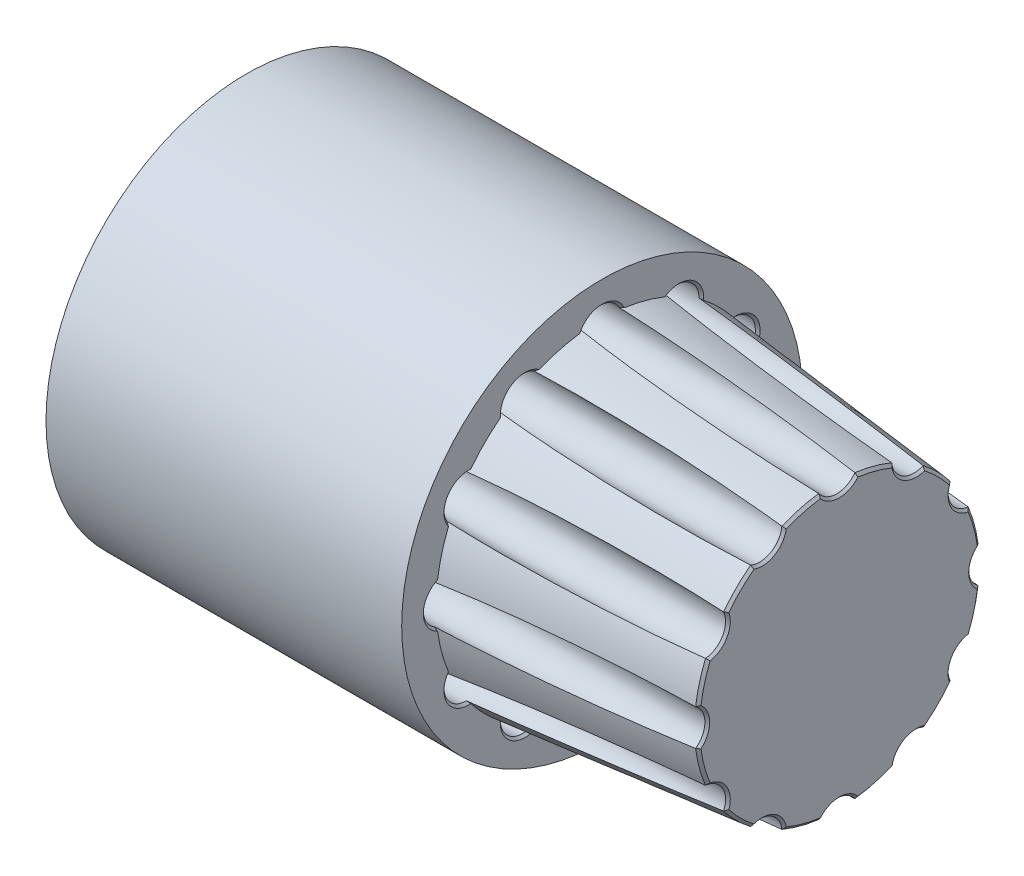
from build123d import *

# Parameters (mm, degrees)
SKETCH1_R              = 21.463
EXTRUDE1_DEPTH         = 38.1
SKETCH2_R              = 17.78
EXTRUDE2_DEPTH         = 25.4
EXTRUDE2_TAPER         = 5.75
CIRPATTERN1_COUNT      = 12
CHAMFER1_SIZE          = 0.254
CHAMFER1_SIZE2         = 0.283868516
CHAMFER1_EDGE_2_SIZE   = 0.254
CHAMFER1_EDGE_3_SIZE   = 0.254
CHAMFER1_EDGE_3_SIZE2  = 0.283868516
CHAMFER1_EDGE_4_SIZE   = 0.254
CHAMFER1_EDGE_5_SIZE   = 0.254
CHAMFER1_EDGE_5_SIZE2  = 0.283868516
CHAMFER1_EDGE_6_SIZE   = 0.254
CHAMFER1_EDGE_7_SIZE   = 0.254
CHAMFER1_EDGE_7_SIZE2  = 0.283868516
CHAMFER1_EDGE_8_SIZE   = 0.254
CHAMFER1_EDGE_9_SIZE   = 0.254
CHAMFER1_EDGE_9_SIZE2  = 0.283868516
CHAMFER1_EDGE_10_SIZE  = 0.254
CHAMFER1_EDGE_11_SIZE  = 0.254
CHAMFER1_EDGE_11_SIZE2 = 0.283868516
CHAMFER1_EDGE_12_SIZE  = 0.254
CHAMFER1_EDGE_13_SIZE  = 0.254
CHAMFER1_EDGE_13_SIZE2 = 0.283868516
CHAMFER1_EDGE_14_SIZE  = 0.254
CHAMFER1_EDGE_15_SIZE  = 0.254
CHAMFER1_EDGE_15_SIZE2 = 0.283868516
CHAMFER1_EDGE_16_SIZE  = 0.254
CHAMFER1_EDGE_17_SIZE  = 0.254
CHAMFER1_EDGE_17_SIZE2 = 0.283868516
CHAMFER1_EDGE_18_SIZE  = 0.254
CHAMFER1_EDGE_19_SIZE  = 0.254
CHAMFER1_EDGE_19_SIZE2 = 0.283868516
CHAMFER1_EDGE_20_SIZE  = 0.254
CHAMFER1_EDGE_21_SIZE  = 0.254
CHAMFER1_EDGE_21_SIZE2 = 0.283868516
CHAMFER1_EDGE_22_SIZE  = 0.254
CHAMFER1_EDGE_23_SIZE  = 0.254
CHAMFER1_EDGE_23_SIZE2 = 0.283868516
CHAMFER1_EDGE_24_SIZE  = 0.254
CHAMFER1_EDGE_25_SIZE  = 0.254
CHAMFER1_EDGE_26_SIZE  = 0.254
CHAMFER1_EDGE_27_SIZE  = 0.254
CHAMFER1_EDGE_28_SIZE  = 0.254
CHAMFER1_EDGE_29_SIZE  = 0.254
CHAMFER1_EDGE_30_SIZE  = 0.254
CHAMFER1_EDGE_31_SIZE  = 0.254
CHAMFER1_EDGE_32_SIZE  = 0.254
CHAMFER1_EDGE_33_SIZE  = 0.254
CHAMFER1_EDGE_34_SIZE  = 0.254
CHAMFER1_EDGE_35_SIZE  = 0.254
CHAMFER1_EDGE_36_SIZE  = 0.254


with BuildPart() as part:
    # Sketch1 → Extrude1 (new body)
    with BuildSketch(Plane(origin=(0, 0, 0), x_dir=(0, 0, -1), z_dir=(1, 0, 0))):
        with Locations(Location((0, 0, 0), (0, 0, 180))):
            Circle(SKETCH1_R)
    extrude(amount=EXTRUDE1_DEPTH)

    # Sketch2 → Extrude2 (add)
    with BuildSketch(Plane(origin=(38.1, 0, 0), x_dir=(0, 0, -1), z_dir=(1, 0, 0))):
        Circle(SKETCH2_R)
    extrude(amount=EXTRUDE2_DEPTH, taper=EXTRUDE2_TAPER)

    # Sketch4 → 3/16 (0.1875) Diameter Hole1 (revolve, cut)
    with BuildSketch(Plane(origin=(63.5, 0, 16.51), x_dir=(0, 0, -1), z_dir=(0, 1, 0))):
        Polygon((0, 0), (0, 33.180799349), (2.38125, 31.75), (2.38125, 0), align=None)
    f_3_16_0_1875_diameter_hole1 = revolve(axis=Axis((69.85, 0, 16.51), (-1, 0, 0)), mode=Mode.SUBTRACT)

    # CirPattern1: 3/16 (0.1875) Diameter Hole1 ×12 about axis
    cirpattern1_axis = Axis((0, 0, 0), (1, 0, 0))
    for i in range(1, CIRPATTERN1_COUNT):
        add(f_3_16_0_1875_diameter_hole1.rotate(cirpattern1_axis, i * 360 / CIRPATTERN1_COUNT), mode=Mode.SUBTRACT)

    # Chamfer1
    chamfer1_edges = [part.edges().sort_by_distance(p)[0] for p in [
        (63.5, 10.763830084, 10.763830084),
    ]]
    chamfer1_side = [part.faces().sort_by_distance(p)[0] for p in [
        (50.8, 11.668094327, 11.668094327),
    ]]
    chamfer(chamfer1_edges, length=CHAMFER1_SIZE, length2=CHAMFER1_SIZE2, reference=chamfer1_side[0])

    # Chamfer1 edge 2
    chamfer1_edge_2_edges = [part.edges().sort_by_distance(p)[0] for p in [
        (63.5, 11.920407712, 8.124505445),
    ]]
    chamfer(chamfer1_edge_2_edges, length=CHAMFER1_EDGE_2_SIZE)

    # Chamfer1 edge 3
    chamfer1_edge_3_edges = [part.edges().sort_by_distance(p)[0] for p in [
        (63.5, 14.703665337, 3.939835253),
    ]]
    chamfer1_edge_3_side = [part.faces().sort_by_distance(p)[0] for p in [
        (50.8, 15.938913264, 4.270818937),
    ]]
    chamfer(chamfer1_edge_3_edges, length=CHAMFER1_EDGE_3_SIZE, length2=CHAMFER1_EDGE_3_SIZE2, reference=chamfer1_edge_3_side[0])

    # Chamfer1 edge 4
    chamfer1_edge_4_edges = [part.edges().sort_by_distance(p)[0] for p in [
        (63.5, 14.385628625, 1.075824253),
    ]]
    chamfer(chamfer1_edge_4_edges, length=CHAMFER1_EDGE_4_SIZE)

    # Chamfer1 edge 5
    chamfer1_edge_5_edges = [part.edges().sort_by_distance(p)[0] for p in [
        (63.5, 14.703665337, -3.939835253),
    ]]
    chamfer1_edge_5_side = [part.faces().sort_by_distance(p)[0] for p in [
        (50.8, 15.938913264, -4.270818937),
    ]]
    chamfer(chamfer1_edge_5_edges, length=CHAMFER1_EDGE_5_SIZE, length2=CHAMFER1_EDGE_5_SIZE2, reference=chamfer1_edge_5_side[0])

    # Chamfer1 edge 6
    chamfer1_edge_6_edges = [part.edges().sort_by_distance(p)[0] for p in [
        (63.5, 12.996231965, -6.26112318),
    ]]
    chamfer(chamfer1_edge_6_edges, length=CHAMFER1_EDGE_6_SIZE)

    # Chamfer1 edge 7
    chamfer1_edge_7_edges = [part.edges().sort_by_distance(p)[0] for p in [
        (63.5, 10.763830084, -10.763830084),
    ]]
    chamfer1_edge_7_side = [part.faces().sort_by_distance(p)[0] for p in [
        (50.8, 11.668094327, -11.668094327),
    ]]
    chamfer(chamfer1_edge_7_edges, length=CHAMFER1_EDGE_7_SIZE, length2=CHAMFER1_EDGE_7_SIZE2, reference=chamfer1_edge_7_side[0])

    # Chamfer1 edge 8
    chamfer1_edge_8_edges = [part.edges().sort_by_distance(p)[0] for p in [
        (63.5, 8.124505445, -11.920407712),
    ]]
    chamfer(chamfer1_edge_8_edges, length=CHAMFER1_EDGE_8_SIZE)

    # Chamfer1 edge 9
    chamfer1_edge_9_edges = [part.edges().sort_by_distance(p)[0] for p in [
        (63.5, 3.939835253, -14.703665337),
    ]]
    chamfer1_edge_9_side = [part.faces().sort_by_distance(p)[0] for p in [
        (50.8, 4.270818937, -15.938913264),
    ]]
    chamfer(chamfer1_edge_9_edges, length=CHAMFER1_EDGE_9_SIZE, length2=CHAMFER1_EDGE_9_SIZE2, reference=chamfer1_edge_9_side[0])

    # Chamfer1 edge 10
    chamfer1_edge_10_edges = [part.edges().sort_by_distance(p)[0] for p in [
        (63.5, 1.075824253, -14.385628625),
    ]]
    chamfer(chamfer1_edge_10_edges, length=CHAMFER1_EDGE_10_SIZE)

    # Chamfer1 edge 11
    chamfer1_edge_11_edges = [part.edges().sort_by_distance(p)[0] for p in [
        (63.5, -3.939835253, -14.703665337),
    ]]
    chamfer1_edge_11_side = [part.faces().sort_by_distance(p)[0] for p in [
        (50.8, -4.270818937, -15.938913264),
    ]]
    chamfer(chamfer1_edge_11_edges, length=CHAMFER1_EDGE_11_SIZE, length2=CHAMFER1_EDGE_11_SIZE2, reference=chamfer1_edge_11_side[0])

    # Chamfer1 edge 12
    chamfer1_edge_12_edges = [part.edges().sort_by_distance(p)[0] for p in [
        (63.5, -6.26112318, -12.996231965),
    ]]
    chamfer(chamfer1_edge_12_edges, length=CHAMFER1_EDGE_12_SIZE)

    # Chamfer1 edge 13
    chamfer1_edge_13_edges = [part.edges().sort_by_distance(p)[0] for p in [
        (63.5, -10.763830084, -10.763830084),
    ]]
    chamfer1_edge_13_side = [part.faces().sort_by_distance(p)[0] for p in [
        (50.8, -11.668094327, -11.668094327),
    ]]
    chamfer(chamfer1_edge_13_edges, length=CHAMFER1_EDGE_13_SIZE, length2=CHAMFER1_EDGE_13_SIZE2, reference=chamfer1_edge_13_side[0])

    # Chamfer1 edge 14
    chamfer1_edge_14_edges = [part.edges().sort_by_distance(p)[0] for p in [
        (63.5, -11.920407712, -8.124505445),
    ]]
    chamfer(chamfer1_edge_14_edges, length=CHAMFER1_EDGE_14_SIZE)

    # Chamfer1 edge 15
    chamfer1_edge_15_edges = [part.edges().sort_by_distance(p)[0] for p in [
        (63.5, -14.703665337, -3.939835253),
    ]]
    chamfer1_edge_15_side = [part.faces().sort_by_distance(p)[0] for p in [
        (50.8, -15.938913264, -4.270818937),
    ]]
    chamfer(chamfer1_edge_15_edges, length=CHAMFER1_EDGE_15_SIZE, length2=CHAMFER1_EDGE_15_SIZE2, reference=chamfer1_edge_15_side[0])

    # Chamfer1 edge 16
    chamfer1_edge_16_edges = [part.edges().sort_by_distance(p)[0] for p in [
        (63.5, -14.385628625, -1.075824253),
    ]]
    chamfer(chamfer1_edge_16_edges, length=CHAMFER1_EDGE_16_SIZE)

    # Chamfer1 edge 17
    chamfer1_edge_17_edges = [part.edges().sort_by_distance(p)[0] for p in [
        (63.5, -14.703665337, 3.939835253),
    ]]
    chamfer1_edge_17_side = [part.faces().sort_by_distance(p)[0] for p in [
        (50.8, -15.938913264, 4.270818937),
    ]]
    chamfer(chamfer1_edge_17_edges, length=CHAMFER1_EDGE_17_SIZE, length2=CHAMFER1_EDGE_17_SIZE2, reference=chamfer1_edge_17_side[0])

    # Chamfer1 edge 18
    chamfer1_edge_18_edges = [part.edges().sort_by_distance(p)[0] for p in [
        (63.5, -12.996231965, 6.26112318),
    ]]
    chamfer(chamfer1_edge_18_edges, length=CHAMFER1_EDGE_18_SIZE)

    # Chamfer1 edge 19
    chamfer1_edge_19_edges = [part.edges().sort_by_distance(p)[0] for p in [
        (63.5, -10.763830084, 10.763830084),
    ]]
    chamfer1_edge_19_side = [part.faces().sort_by_distance(p)[0] for p in [
        (50.8, -11.668094327, 11.668094327),
    ]]
    chamfer(chamfer1_edge_19_edges, length=CHAMFER1_EDGE_19_SIZE, length2=CHAMFER1_EDGE_19_SIZE2, reference=chamfer1_edge_19_side[0])

    # Chamfer1 edge 20
    chamfer1_edge_20_edges = [part.edges().sort_by_distance(p)[0] for p in [
        (63.5, -6.26112318, 12.996231965),
    ]]
    chamfer(chamfer1_edge_20_edges, length=CHAMFER1_EDGE_20_SIZE)

    # Chamfer1 edge 21
    chamfer1_edge_21_edges = [part.edges().sort_by_distance(p)[0] for p in [
        (63.5, -3.939835253, 14.703665337),
    ]]
    chamfer1_edge_21_side = [part.faces().sort_by_distance(p)[0] for p in [
        (50.8, -4.270818937, 15.938913264),
    ]]
    chamfer(chamfer1_edge_21_edges, length=CHAMFER1_EDGE_21_SIZE, length2=CHAMFER1_EDGE_21_SIZE2, reference=chamfer1_edge_21_side[0])

    # Chamfer1 edge 22
    chamfer1_edge_22_edges = [part.edges().sort_by_distance(p)[0] for p in [
        (63.5, -1.075824253, 14.385628625),
    ]]
    chamfer(chamfer1_edge_22_edges, length=CHAMFER1_EDGE_22_SIZE)

    # Chamfer1 edge 23
    chamfer1_edge_23_edges = [part.edges().sort_by_distance(p)[0] for p in [
        (63.5, 3.939835253, 14.703665337),
    ]]
    chamfer1_edge_23_side = [part.faces().sort_by_distance(p)[0] for p in [
        (50.8, 4.270818937, 15.938913264),
    ]]
    chamfer(chamfer1_edge_23_edges, length=CHAMFER1_EDGE_23_SIZE, length2=CHAMFER1_EDGE_23_SIZE2, reference=chamfer1_edge_23_side[0])

    # Chamfer1 edge 24
    chamfer1_edge_24_edges = [part.edges().sort_by_distance(p)[0] for p in [
        (63.5, 6.26112318, 12.996231965),
    ]]
    chamfer(chamfer1_edge_24_edges, length=CHAMFER1_EDGE_24_SIZE)

    # Chamfer1 edge 25
    chamfer1_edge_25_edges = [part.edges().sort_by_distance(p)[0] for p in [
        (38.1, -9.445625, 16.360302409),
    ]]
    chamfer(chamfer1_edge_25_edges, length=CHAMFER1_EDGE_25_SIZE)

    # Chamfer1 edge 26
    chamfer1_edge_26_edges = [part.edges().sort_by_distance(p)[0] for p in [
        (38.1, 0, 18.89125),
    ]]
    chamfer(chamfer1_edge_26_edges, length=CHAMFER1_EDGE_26_SIZE)

    # Chamfer1 edge 27
    chamfer1_edge_27_edges = [part.edges().sort_by_distance(p)[0] for p in [
        (38.1, 9.445625, 16.360302409),
    ]]
    chamfer(chamfer1_edge_27_edges, length=CHAMFER1_EDGE_27_SIZE)

    # Chamfer1 edge 28
    chamfer1_edge_28_edges = [part.edges().sort_by_distance(p)[0] for p in [
        (38.1, 16.360302409, 9.445625),
    ]]
    chamfer(chamfer1_edge_28_edges, length=CHAMFER1_EDGE_28_SIZE)

    # Chamfer1 edge 29
    chamfer1_edge_29_edges = [part.edges().sort_by_distance(p)[0] for p in [
        (38.1, 18.89125, 0),
    ]]
    chamfer(chamfer1_edge_29_edges, length=CHAMFER1_EDGE_29_SIZE)

    # Chamfer1 edge 30
    chamfer1_edge_30_edges = [part.edges().sort_by_distance(p)[0] for p in [
        (38.1, 16.360302409, -9.445625),
    ]]
    chamfer(chamfer1_edge_30_edges, length=CHAMFER1_EDGE_30_SIZE)

    # Chamfer1 edge 31
    chamfer1_edge_31_edges = [part.edges().sort_by_distance(p)[0] for p in [
        (38.1, 9.445625, -16.360302409),
    ]]
    chamfer(chamfer1_edge_31_edges, length=CHAMFER1_EDGE_31_SIZE)

    # Chamfer1 edge 32
    chamfer1_edge_32_edges = [part.edges().sort_by_distance(p)[0] for p in [
        (38.1, 0, -18.89125),
    ]]
    chamfer(chamfer1_edge_32_edges, length=CHAMFER1_EDGE_32_SIZE)

    # Chamfer1 edge 33
    chamfer1_edge_33_edges = [part.edges().sort_by_distance(p)[0] for p in [
        (38.1, -9.445625, -16.360302409),
    ]]
    chamfer(chamfer1_edge_33_edges, length=CHAMFER1_EDGE_33_SIZE)

    # Chamfer1 edge 34
    chamfer1_edge_34_edges = [part.edges().sort_by_distance(p)[0] for p in [
        (38.1, -16.360302409, -9.445625),
    ]]
    chamfer(chamfer1_edge_34_edges, length=CHAMFER1_EDGE_34_SIZE)

    # Chamfer1 edge 35
    chamfer1_edge_35_edges = [part.edges().sort_by_distance(p)[0] for p in [
        (38.1, -18.89125, 0),
    ]]
    chamfer(chamfer1_edge_35_edges, length=CHAMFER1_EDGE_35_SIZE)

    # Chamfer1 edge 36
    chamfer1_edge_36_edges = [part.edges().sort_by_distance(p)[0] for p in [
        (38.1, -16.360302409, 9.445625),
    ]]
    chamfer(chamfer1_edge_36_edges, length=CHAMFER1_EDGE_36_SIZE)


solid = part.part
